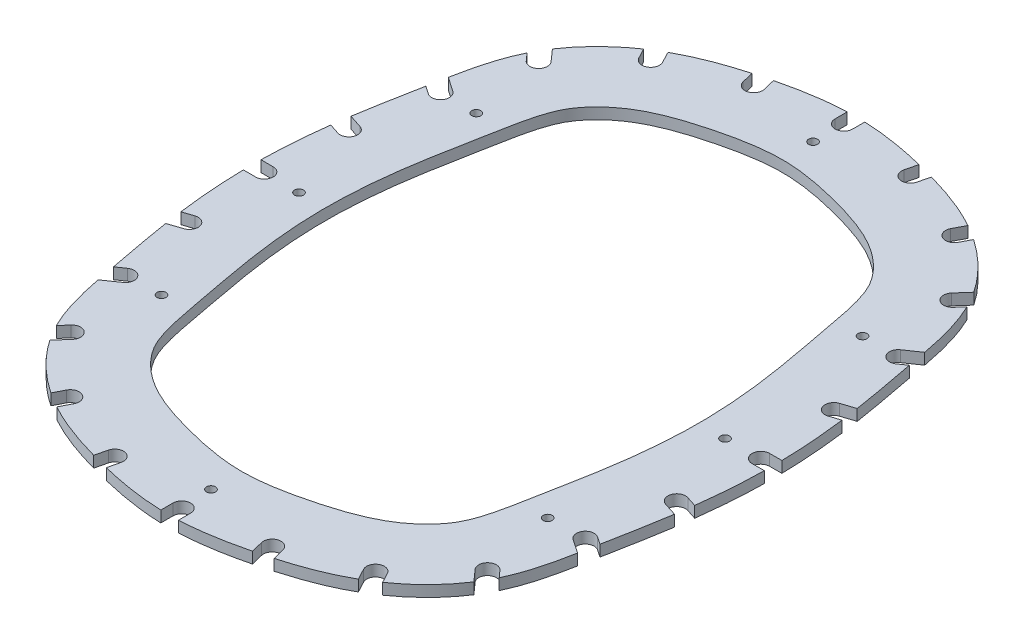
from build123d import *

# Parameters (mm, degrees)
MAINBODY_DEPTH         = 6.35
EXTRUDE2LIP_DEPTH      = 6.35
SLOTS_REACH            = 247.285
OUTERRIDGE_DEPTH       = 246.211628025
F_10_CLEARANCE_HOLE1_D = 5.1054


with BuildPart() as part:
    # Sketch3 → MainBody (new body)
    with BuildSketch(Plane(origin=(0, 0, 0), x_dir=(1, 0, 0), z_dir=(0, 1, 0))):
        with BuildLine():
            add(Edge.make_bspline(
                [(0, 188.5), (-14.941162527, 188.5), (-44.823487582, 182.843892452), (-87.706049673, 168.159111938), (-121.852313727, 134.636427653), (-129.884695419, 89.134437602), (-138.621843095, 45.225812557), (-142.191717787, 0), (-138.621843095, -45.225812557), (-129.884695419, -89.134437602), (-121.852313727, -134.636427653), (-87.706049673, -168.159111938), (-44.823487582, -182.843892452), (0, -191.328053774), (44.823487582, -182.843892452), (87.706049673, -168.159111938), (121.852313727, -134.636427653), (129.884695419, -89.134437602), (138.621843095, -45.225812557), (142.191717787, 0), (138.621843095, 45.225812557), (129.884695419, 89.134437602), (121.852313727, 134.636427653), (87.706049673, 168.159111938), (44.823487582, 182.843892452), (14.941162527, 188.5), (0, 188.5)],
                knots=[0, 0, 0, 0, 0.041635793, 0.083271585, 0.124907378, 0.16654317, 0.208178963, 0.25, 0.291821037, 0.33345683, 0.375092622, 0.416728415, 0.458364207, 0.5, 0.541635793, 0.583271585, 0.624907378, 0.66654317, 0.708178963, 0.75, 0.791821037, 0.83345683, 0.875092622, 0.916728415, 0.958364207, 1, 1, 1, 1], degree=3))
        make_face()
    extrude(amount=MAINBODY_DEPTH)

    # Sketch13 → Extrude2Lip (add)
    with BuildSketch(Plane(origin=(0, 6.35, 0), x_dir=(1, 0, 0), z_dir=(0, 1, 0))):
        with BuildLine():
            add(Edge.make_bspline(
                [(0, -195.5), (5.906115375, -195.5), (11.739195872, -195.084984565), (23.298077894, -193.645348644), (29.023728053, -192.619868034), (37.555871291, -190.761544581), (40.39049511, -190.088552644), (46.044676215, -188.656954276), (48.864921579, -187.902257804), (53.082890192, -186.699754208), (54.486714442, -186.286615582), (57.289305258, -185.431598406), (58.688243661, -184.989623348), (62.860379765, -183.619676082), (65.613822792, -182.646192636), (73.77141149, -179.504754903), (79.072754195, -177.115678614), (86.746243908, -172.932977756), (89.257491392, -171.438548603), (92.946316747, -169.029033652), (94.165319291, -168.196511607), (96.557546407, -166.488918083), (97.732563489, -165.612814334), (101.194392523, -162.917653202), (103.418219259, -161.031996528), (107.69233996, -157.077193142), (109.742668291, -155.00808277), (112.677958925, -151.756170601), (113.632956768, -150.647422967), (115.028372949, -148.945093257), (115.487326488, -148.371109928), (116.392474829, -147.20965244), (116.839338405, -146.621257934), (119.030573362, -143.658210244), (120.64656578, -141.220867563), (123.591597471, -136.206042865), (124.915266819, -133.625938338), (127.292327657, -128.33373366), (128.348545396, -125.623013765), (129.772332418, -121.478531188), (130.220196568, -120.083982119), (131.069128633, -117.272030098), (131.469388991, -115.857107224), (132.604182694, -111.609548526), (133.275494683, -108.765553515), (134.514450297, -103.062613421), (135.081938087, -100.203645864), (136.177461847, -94.480021381), (136.706994613, -91.615580309), (138.3251321, -83.026516956), (139.421519585, -77.303017032), (141.529256477, -65.843753794), (142.540336408, -60.10795162), (143.90345449, -51.482111775), (144.332272137, -48.60314652), (145.124685679, -42.835810343), (145.488497948, -39.947470625), (147.136247264, -25.481067032), (147.910082799, -13.829441133), (148.003006893, -0.609217968), (148.0023736, 0.862331764), (147.979203162, 3.801894823), (147.956752685, 5.27006874), (147.857814722, 9.669916978), (147.749754953, 12.596919894), (147.306795971, 21.360354119), (146.853296686, 27.179237475), (145.66507575, 38.7753948), (144.928391479, 44.552378381), (143.212586909, 56.070474943), (142.23886945, 61.812387324), (140.177500227, 73.279354476), (139.090111019, 79.004448095), (137.464486442, 87.592896267), (136.926184428, 90.456240959), (135.853126125, 96.183454965), (135.312193466, 99.046410429), (133.578587399, 107.618881764), (132.277900519, 113.312416067), (130.135273916, 120.352873454), (129.682357657, 121.751377667), (128.723343105, 124.518671013), (128.21689863, 125.888607747), (126.60731386, 129.952483687), (125.413822323, 132.600437786), (122.738479294, 137.749582497), (121.254404044, 140.249641308), (118.821507232, 143.894484911), (117.976071295, 145.091888782), (116.217688583, 147.452336253), (115.303326613, 148.616751432), (112.494248952, 152.019914378), (110.524173049, 154.182685716), (106.407673375, 158.316218743), (104.261183057, 160.286907974), (99.801271424, 164.046529989), (97.487838734, 165.835450387), (93.893881499, 168.384027148), (92.672428471, 169.212783092), (90.202682616, 170.815071843), (88.955394486, 171.587904561), (82.659783468, 175.317135892), (77.434836444, 177.870760382), (66.703482616, 182.336167776), (61.196906491, 184.247564558), (54.197768861, 186.372472039), (52.7909995, 186.784579313), (49.973582507, 187.584202272), (48.563427693, 187.971611211), (44.329352787, 189.102877354), (41.502078374, 189.8179704), (33.003161014, 191.816663072), (27.314350217, 192.953043965), (15.870842915, 194.660818892), (10.116213474, 195.23278801), (1.418194954, 195.524137097), (-1.492514209, 195.52375573), (-7.337173544, 195.323695383), (-10.270807364, 195.126729205), (-14.686612566, 194.699611386), (-16.160898761, 194.535232112), (-19.094296849, 194.167885124), (-20.556040537, 193.964686132), (-24.927681058, 193.301538591), (-27.824004999, 192.788109027), (-36.468107076, 191.071020911), (-42.17153696, 189.692617767), (-53.502576857, 186.637059847), (-59.126183681, 184.944131381), (-66.062440425, 182.460532517), (-67.445015269, 181.945386002), (-70.199719123, 180.87393344), (-71.573716066, 180.316823815), (-75.663913573, 178.58323116), (-78.343211305, 177.346845481), (-83.593471613, 174.690118255), (-86.164439878, 173.26978637), (-91.185757227, 170.224308146), (-93.635715508, 168.598498213), (-97.216876261, 166.000548133), (-98.394954126, 165.108003602), (-100.718882108, 163.268190998), (-101.865533518, 162.320007853), (-105.223402308, 159.418577369), (-107.363729115, 157.40037992), (-111.441834365, 153.191002694), (-113.37964364, 150.999849249), (-117.037838488, 146.431856051), (-118.758320666, 144.055098803), (-121.156847892, 140.33436209), (-121.925899347, 139.068104806), (-123.030384879, 137.12679315), (-123.389793208, 136.473601532), (-124.087032538, 135.161787057), (-124.425457864, 134.502197826), (-126.069185967, 131.186771085), (-127.229427255, 128.478540244), (-130.340842927, 120.220460927), (-131.92233491, 114.537090503), (-134.590856441, 102.991759635), (-135.664344943, 97.192136998), (-137.835547346, 85.598679936), (-138.947717024, 79.804324746), (-141.102949482, 68.209441102), (-142.14514109, 62.408834827), (-143.561835264, 53.694830359), (-144.009674048, 50.787983231), (-144.84185299, 44.968616694), (-145.225531441, 42.056038176), (-146.969951254, 27.477604764), (-147.81497066, 15.765680845), (-148.05214775, -1.894245549), (-147.953847743, -7.79673102), (-147.422537103, -19.631601392), (-146.990917008, -25.563862077), (-146.11429037, -34.482727043), (-145.783752506, -37.459181062), (-145.052722161, -43.394087641), (-144.65146401, -46.355639149), (-143.351636068, -55.224433593), (-142.359953908, -61.116302074), (-140.253044804, -72.879639666), (-139.138099116, -78.751155218), (-137.470827885, -87.559278454), (-136.918863825, -90.495966622), (-135.818089008, -96.369779148), (-135.262680803, -99.305273048), (-133.479399827, -108.07882648), (-132.135206603, -113.88416476), (-129.48930931, -122.415061922), (-128.50239561, -125.229172176), (-126.811717352, -129.391177437), (-126.213066806, -130.768641296), (-125.255339139, -132.818028732), (-124.92625704, -133.497986535), (-124.251641166, -134.84302841), (-123.905599809, -135.509198789), (-122.13060998, -138.807486431), (-120.568758369, -141.342962393), (-117.192510934, -146.230275301), (-115.377996564, -148.582026046), (-111.51485991, -153.115294585), (-109.464652362, -155.298278425), (-105.144856894, -159.494038584), (-102.903607584, -161.479745044), (-95.95434675, -167.12591042), (-91.021134394, -170.475845637), (-84.496742878, -174.169798449), (-83.171637731, -174.885618839), (-80.502800709, -176.26321899), (-79.159431703, -176.92498945), (-75.104662865, -178.835824554), (-72.368619207, -180.010467263), (-64.078607471, -183.287123531), (-58.442856204, -185.142159887), (-49.888781887, -187.621373091), (-47.021062012, -188.398366556), (-41.260502164, -189.876493257), (-38.366430247, -190.573906142), (-32.542929173, -191.86195652), (-29.609900622, -192.453109041), (-23.734953504, -193.497503723), (-20.790109937, -193.951534575), (-14.883056044, -194.698968084), (-11.920847988, -194.992391742), (-7.462425561, -195.292769035), (-5.973764921, -195.369588436), (-3.736717617, -195.447299706), (-2.617179714, -195.476774359), (-1.309214561, -195.494165182), (-0.654764607, -195.498537732), (-0.374185041, -195.499477379), (-0.187109452, -195.499895297), (-0.092283053, -195.5), (0, -195.5)],
                knots=[0, 0, 0, 0, 0.015625, 0.015625, 0.03125, 0.03125, 0.0390625, 0.0390625, 0.046875, 0.046875, 0.05078125, 0.05078125, 0.0546875, 0.0546875, 0.0625, 0.0625, 0.078125, 0.078125, 0.0859375, 0.0859375, 0.08984375, 0.08984375, 0.09375, 0.09375, 0.1015625, 0.1015625, 0.109375, 0.109375, 0.11328125, 0.11328125, 0.115234375, 0.115234375, 0.1171875, 0.1171875, 0.125, 0.125, 0.1328125, 0.1328125, 0.140625, 0.140625, 0.14453125, 0.14453125, 0.1484375, 0.1484375, 0.15625, 0.15625, 0.1640625, 0.1640625, 0.171875, 0.171875, 0.1875, 0.1875, 0.203125, 0.203125, 0.2109375, 0.2109375, 0.21875, 0.21875, 0.25, 0.25, 0.25390625, 0.25390625, 0.2578125, 0.2578125, 0.265625, 0.265625, 0.28125, 0.28125, 0.296875, 0.296875, 0.3125, 0.3125, 0.328125, 0.328125, 0.3359375, 0.3359375, 0.34375, 0.34375, 0.359375, 0.359375, 0.36328125, 0.36328125, 0.3671875, 0.3671875, 0.375, 0.375, 0.3828125, 0.3828125, 0.38671875, 0.38671875, 0.390625, 0.390625, 0.3984375, 0.3984375, 0.40625, 0.40625, 0.4140625, 0.4140625, 0.41796875, 0.41796875, 0.421875, 0.421875, 0.4375, 0.4375, 0.453125, 0.453125, 0.45703125, 0.45703125, 0.4609375, 0.4609375, 0.46875, 0.46875, 0.484375, 0.484375, 0.5, 0.5, 0.5078125, 0.5078125, 0.515625, 0.515625, 0.51953125, 0.51953125, 0.5234375, 0.5234375, 0.53125, 0.53125, 0.546875, 0.546875, 0.5625, 0.5625, 0.56640625, 0.56640625, 0.5703125, 0.5703125, 0.578125, 0.578125, 0.5859375, 0.5859375, 0.59375, 0.59375, 0.59765625, 0.59765625, 0.6015625, 0.6015625, 0.609375, 0.609375, 0.6171875, 0.6171875, 0.625, 0.625, 0.62890625, 0.62890625, 0.630859375, 0.630859375, 0.6328125, 0.6328125, 0.640625, 0.640625, 0.65625, 0.65625, 0.671875, 0.671875, 0.6875, 0.6875, 0.703125, 0.703125, 0.7109375, 0.7109375, 0.71875, 0.71875, 0.75, 0.75, 0.765625, 0.765625, 0.78125, 0.78125, 0.7890625, 0.7890625, 0.796875, 0.796875, 0.8125, 0.8125, 0.828125, 0.828125, 0.8359375, 0.8359375, 0.84375, 0.84375, 0.859375, 0.859375, 0.8671875, 0.8671875, 0.87109375, 0.87109375, 0.873046875, 0.873046875, 0.875, 0.875, 0.8828125, 0.8828125, 0.890625, 0.890625, 0.8984375, 0.8984375, 0.90625, 0.90625, 0.921875, 0.921875, 0.92578125, 0.92578125, 0.9296875, 0.9296875, 0.9375, 0.9375, 0.953125, 0.953125, 0.9609375, 0.9609375, 0.96875, 0.96875, 0.9765625, 0.9765625, 0.984375, 0.984375, 0.9921875, 0.9921875, 0.99609375, 0.99609375, 0.998046875, 0.999023438, 0.999511719, 0.999755859, 0.999755859, 1, 1, 1, 1], degree=3))
        make_face()
    extrude(amount=-EXTRUDE2LIP_DEPTH)

    # Sketch14 → Slots (cut, up to next)
    with BuildSketch(Plane(origin=(0, 6.35, 0), x_dir=(1, 0, 0), z_dir=(0, 1, 0)), mode=Mode.PRIVATE) as slots_sk1:
        with BuildLine():
            Line((-5, 188.5), (-5, 199.179815437))
            Line((-5, 199.179815437), (5, 199.179815437))
            Line((5, 199.179815437), (5, 188.5))
            ThreePointArc((5, 188.5), (0, 183.5), (-5, 188.5))
        make_face()
    slots_tool1 = extrude(slots_sk1.sketch, amount=-SLOTS_REACH, mode=Mode.PRIVATE) & part.part
    # Sketch14 → Slots (cut, up to next)
    with BuildSketch(Plane(origin=(0, 6.35, 0), x_dir=(1, 0, 0), z_dir=(0, 1, 0)), mode=Mode.PRIVATE) as slots_sk2:
        with BuildLine():
            Line((39.64335913, 182.999169284), (42.182406998, 193.372774911))
            Line((42.182406998, 193.372774911), (51.895688737, 190.995348183))
            Line((51.895688737, 190.995348183), (49.35664087, 180.621742556))
            ThreePointArc((49.35664087, 180.621742556), (43.311286636, 176.95381505), (39.64335913, 182.999169284))
        make_face()
    slots_tool2 = extrude(slots_sk2.sketch, amount=-SLOTS_REACH, mode=Mode.PRIVATE) & part.part
    # Sketch14 → Slots (cut, up to next)
    with BuildSketch(Plane(origin=(0, 6.35, 0), x_dir=(1, 0, 0), z_dir=(0, 1, 0)), mode=Mode.PRIVATE) as slots_sk3:
        with BuildLine():
            Line((81.818760635, 167.335517805), (86.765771818, 176.800481521))
            Line((86.765771818, 176.800481521), (95.628250548, 172.16836853))
            Line((95.628250548, 172.16836853), (90.681239365, 162.703404814))
            ThreePointArc((90.681239365, 162.703404814), (83.933943505, 160.588221945), (81.818760635, 167.335517805))
        make_face()
    slots_tool3 = extrude(slots_sk3.sketch, amount=-SLOTS_REACH, mode=Mode.PRIVATE) & part.part
    # Sketch14 → Slots (cut, up to next)
    with BuildSketch(Plane(origin=(0, 6.35, 0), x_dir=(1, 0, 0), z_dir=(0, 1, 0)), mode=Mode.PRIVATE) as slots_sk4:
        with BuildLine():
            Line((113.757324738, 135.955352809), (125.889061564, 149.6502641))
            Line((125.889061564, 149.6502641), (133.374412089, 143.019311866))
            Line((133.374412089, 143.019311866), (121.242675262, 129.324400575))
            ThreePointArc((121.242675262, 129.324400575), (114.184523883, 128.89720143), (113.757324738, 135.955352809))
        make_face()
    slots_tool4 = extrude(slots_sk4.sketch, amount=-SLOTS_REACH, mode=Mode.PRIVATE) & part.part
    # Sketch14 → Slots (cut, up to next)
    with BuildSketch(Plane(origin=(0, 6.35, 0), x_dir=(1, 0, 0), z_dir=(0, 1, 0)), mode=Mode.PRIVATE) as slots_sk5:
        with BuildLine():
            Line((127.166584796, 93.530514919), (142.252668174, 103.906355838))
            Line((142.252668174, 103.906355838), (147.91949858, 95.666997057))
            Line((147.91949858, 95.666997057), (132.833415203, 85.291156137))
            ThreePointArc((132.833415203, 85.291156137), (125.880320609, 86.577420324), (127.166584796, 93.530514919))
        make_face()
    slots_tool5 = extrude(slots_sk5.sketch, amount=-SLOTS_REACH, mode=Mode.PRIVATE) & part.part
    # Sketch14 → Slots (cut, up to next)
    with BuildSketch(Plane(origin=(0, 6.35, 0), x_dir=(1, 0, 0), z_dir=(0, 1, 0)), mode=Mode.PRIVATE) as slots_sk6:
        with BuildLine():
            Line((136.194761018, 49.835191332), (153.596269533, 55.530407567))
            Line((153.596269533, 55.530407567), (156.706747497, 46.026464867))
            Line((156.706747497, 46.026464867), (139.305238982, 40.331248632))
            ThreePointArc((139.305238982, 40.331248632), (132.99802865, 43.527981), (136.194761018, 49.835191332))
        make_face()
    slots_tool6 = extrude(slots_sk6.sketch, amount=-SLOTS_REACH, mode=Mode.PRIVATE) & part.part
    # Sketch14 → Slots (cut, up to next)
    with BuildSketch(Plane(origin=(0, 6.35, 0), x_dir=(1, 0, 0), z_dir=(0, 1, 0)), mode=Mode.PRIVATE) as slots_sk7:
        with BuildLine():
            Line((140.987818654, 5.34350015), (159.297542756, 5.388107701))
            Line((159.297542756, 5.388107701), (159.321905449, -4.611862622))
            Line((159.321905449, -4.611862622), (141.012181346, -4.656470173))
            ThreePointArc((141.012181346, -4.656470173), (136.000014839, 0.331333642), (140.987818654, 5.34350015))
        make_face()
    slots_tool7 = extrude(slots_sk7.sketch, amount=-SLOTS_REACH, mode=Mode.PRIVATE) & part.part
    # Sketch14 → Slots (cut, up to next)
    with BuildSketch(Plane(origin=(0, 6.35, 0), x_dir=(1, 0, 0), z_dir=(0, 1, 0)), mode=Mode.PRIVATE) as slots_sk8:
        with BuildLine():
            Line((-159.321905449, -4.611862622), (-141.012181346, -4.656470173))
            ThreePointArc((-141.012181346, -4.656470173), (-136.000014839, 0.331333642), (-140.987818654, 5.34350015))
            Line((-140.987818654, 5.34350015), (-159.297542756, 5.388107701))
            Line((-159.297542756, 5.388107701), (-159.321905449, -4.611862622))
        make_face()
    slots_tool8 = extrude(slots_sk8.sketch, amount=-SLOTS_REACH, mode=Mode.PRIVATE) & part.part
    # Sketch14 → Slots (cut, up to next)
    with BuildSketch(Plane(origin=(0, 6.35, 0), x_dir=(1, 0, 0), z_dir=(0, 1, 0)), mode=Mode.PRIVATE) as slots_sk9:
        with BuildLine():
            Line((-156.706747497, 46.026464867), (-139.305238982, 40.331248632))
            ThreePointArc((-139.305238982, 40.331248632), (-132.99802865, 43.527981), (-136.194761018, 49.835191332))
            Line((-136.194761018, 49.835191332), (-153.596269533, 55.530407567))
            Line((-153.596269533, 55.530407567), (-156.706747497, 46.026464867))
        make_face()
    slots_tool9 = extrude(slots_sk9.sketch, amount=-SLOTS_REACH, mode=Mode.PRIVATE) & part.part
    # Sketch14 → Slots (cut, up to next)
    with BuildSketch(Plane(origin=(0, 6.35, 0), x_dir=(1, 0, 0), z_dir=(0, 1, 0)), mode=Mode.PRIVATE) as slots_sk10:
        with BuildLine():
            Line((-147.91949858, 95.666997057), (-132.833415203, 85.291156137))
            ThreePointArc((-132.833415203, 85.291156137), (-125.880320609, 86.577420324), (-127.166584796, 93.530514919))
            Line((-127.166584796, 93.530514919), (-142.252668174, 103.906355838))
            Line((-142.252668174, 103.906355838), (-147.91949858, 95.666997057))
        make_face()
    slots_tool10 = extrude(slots_sk10.sketch, amount=-SLOTS_REACH, mode=Mode.PRIVATE) & part.part
    # Sketch14 → Slots (cut, up to next)
    with BuildSketch(Plane(origin=(0, 6.35, 0), x_dir=(1, 0, 0), z_dir=(0, 1, 0)), mode=Mode.PRIVATE) as slots_sk11:
        with BuildLine():
            Line((-133.374412089, 143.019311866), (-121.242675262, 129.324400575))
            ThreePointArc((-121.242675262, 129.324400575), (-114.184523883, 128.89720143), (-113.757324738, 135.955352809))
            Line((-113.757324738, 135.955352809), (-125.889061564, 149.6502641))
            Line((-125.889061564, 149.6502641), (-133.374412089, 143.019311866))
        make_face()
    slots_tool11 = extrude(slots_sk11.sketch, amount=-SLOTS_REACH, mode=Mode.PRIVATE) & part.part
    # Sketch14 → Slots (cut, up to next)
    with BuildSketch(Plane(origin=(0, 6.35, 0), x_dir=(1, 0, 0), z_dir=(0, 1, 0)), mode=Mode.PRIVATE) as slots_sk12:
        with BuildLine():
            Line((-95.628250548, 172.16836853), (-90.681239365, 162.703404814))
            ThreePointArc((-90.681239365, 162.703404814), (-83.933943505, 160.588221945), (-81.818760635, 167.335517805))
            Line((-81.818760635, 167.335517805), (-86.765771818, 176.800481521))
            Line((-86.765771818, 176.800481521), (-95.628250548, 172.16836853))
        make_face()
    slots_tool12 = extrude(slots_sk12.sketch, amount=-SLOTS_REACH, mode=Mode.PRIVATE) & part.part
    # Sketch14 → Slots (cut, up to next)
    with BuildSketch(Plane(origin=(0, 6.35, 0), x_dir=(1, 0, 0), z_dir=(0, 1, 0)), mode=Mode.PRIVATE) as slots_sk13:
        with BuildLine():
            Line((-51.895688737, 190.995348183), (-49.35664087, 180.621742556))
            ThreePointArc((-49.35664087, 180.621742556), (-43.311286636, 176.95381505), (-39.64335913, 182.999169284))
            Line((-39.64335913, 182.999169284), (-42.182406998, 193.372774911))
            Line((-42.182406998, 193.372774911), (-51.895688737, 190.995348183))
        make_face()
    slots_tool13 = extrude(slots_sk13.sketch, amount=-SLOTS_REACH, mode=Mode.PRIVATE) & part.part
    # Sketch14 → Slots (cut, up to next)
    with BuildSketch(Plane(origin=(0, 6.35, 0), x_dir=(1, 0, 0), z_dir=(0, 1, 0)), mode=Mode.PRIVATE) as slots_sk14:
        with BuildLine():
            Line((-38.751220666, -183.190160158), (-41.23969275, -193.576014214))
            Line((-41.23969275, -193.576014214), (-50.964443254, -191.245943907))
            Line((-50.964443254, -191.245943907), (-48.47597117, -180.860089851))
            ThreePointArc((-48.47597117, -180.860089851), (-42.448560765, -177.162749752), (-38.751220666, -183.190160158))
        make_face()
    slots_tool14 = extrude(slots_sk14.sketch, amount=-SLOTS_REACH, mode=Mode.PRIVATE) & part.part
    # Sketch14 → Slots (cut, up to next)
    with BuildSketch(Plane(origin=(0, 6.35, 0), x_dir=(1, 0, 0), z_dir=(0, 1, 0)), mode=Mode.PRIVATE) as slots_sk15:
        with BuildLine():
            Line((-81.002443034, -167.73219528), (-85.903277228, -177.22115107))
            Line((-85.903277228, -177.22115107), (-94.788220835, -172.632275707))
            Line((-94.788220835, -172.632275707), (-89.887386642, -163.143319917))
            ThreePointArc((-89.887386642, -163.143319917), (-83.150477157, -160.995285795), (-81.002443034, -167.73219528))
        make_face()
    slots_tool15 = extrude(slots_sk15.sketch, amount=-SLOTS_REACH, mode=Mode.PRIVATE) & part.part
    # Sketch14 → Slots (cut, up to next)
    with BuildSketch(Plane(origin=(0, 6.35, 0), x_dir=(1, 0, 0), z_dir=(0, 1, 0)), mode=Mode.PRIVATE) as slots_sk16:
        with BuildLine():
            Line((-113.093528611, -136.508024216), (-125.158392638, -150.261885117))
            Line((-125.158392638, -150.261885117), (-132.67596378, -143.667484149))
            Line((-132.67596378, -143.667484149), (-120.611099753, -129.913623248))
            ThreePointArc((-120.611099753, -129.913623248), (-113.555113698, -129.452038161), (-113.093528611, -136.508024216))
        make_face()
    slots_tool16 = extrude(slots_sk16.sketch, amount=-SLOTS_REACH, mode=Mode.PRIVATE) & part.part
    # Sketch14 → Slots (cut, up to next)
    with BuildSketch(Plane(origin=(0, 6.35, 0), x_dir=(1, 0, 0), z_dir=(0, 1, 0)), mode=Mode.PRIVATE) as slots_sk17:
        with BuildLine():
            Line((-126.709345536, -94.149026886), (-141.744693295, -104.59825194))
            Line((-141.744693295, -104.59825194), (-147.451602905, -96.386602736))
            Line((-147.451602905, -96.386602736), (-132.416255148, -85.93737768))
            ThreePointArc((-132.416255148, -85.93737768), (-125.456975739, -87.189747477), (-126.709345536, -94.149026886))
        make_face()
    slots_tool17 = extrude(slots_sk17.sketch, amount=-SLOTS_REACH, mode=Mode.PRIVATE) & part.part
    # Sketch14 → Slots (cut, up to next)
    with BuildSketch(Plane(origin=(0, 6.35, 0), x_dir=(1, 0, 0), z_dir=(0, 1, 0)), mode=Mode.PRIVATE) as slots_sk18:
        with BuildLine():
            Line((-135.950321104, -50.498212004), (-153.32387297, -56.278149902))
            Line((-153.32387297, -56.278149902), (-156.4806222, -46.789475901))
            Line((-156.4806222, -46.789475901), (-139.107070333, -41.009538003))
            ThreePointArc((-139.107070333, -41.009538003), (-132.784358718, -44.175500389), (-135.950321104, -50.498212004))
        make_face()
    slots_tool18 = extrude(slots_sk18.sketch, amount=-SLOTS_REACH, mode=Mode.PRIVATE) & part.part
    # Sketch14 → Slots (cut, up to next)
    with BuildSketch(Plane(origin=(0, 6.35, 0), x_dir=(1, 0, 0), z_dir=(0, 1, 0)), mode=Mode.PRIVATE) as slots_sk19:
        with BuildLine():
            Line((156.929152319, -45.262361089), (139.500100296, -39.652001731))
            ThreePointArc((139.500100296, -39.652001731), (133.208540992, -42.879428186), (136.435967447, -49.17098749))
            Line((136.435967447, -49.17098749), (153.86501947, -54.781346849))
            Line((153.86501947, -54.781346849), (156.929152319, -45.262361089))
        make_face()
    slots_tool19 = extrude(slots_sk19.sketch, amount=-SLOTS_REACH, mode=Mode.PRIVATE) & part.part
    # Sketch14 → Slots (cut, up to next)
    with BuildSketch(Plane(origin=(0, 6.35, 0), x_dir=(1, 0, 0), z_dir=(0, 1, 0)), mode=Mode.PRIVATE) as slots_sk20:
        with BuildLine():
            Line((148.383882405, -94.945120089), (133.247421577, -84.642909643))
            ThreePointArc((133.247421577, -84.642909643), (126.300676875, -85.963037682), (127.620804915, -92.909782384))
            Line((127.620804915, -92.909782384), (142.757265743, -103.211992829))
            Line((142.757265743, -103.211992829), (148.383882405, -94.945120089))
        make_face()
    slots_tool20 = extrude(slots_sk20.sketch, amount=-SLOTS_REACH, mode=Mode.PRIVATE) & part.part
    # Sketch14 → Slots (cut, up to next)
    with BuildSketch(Plane(origin=(0, 6.35, 0), x_dir=(1, 0, 0), z_dir=(0, 1, 0)), mode=Mode.PRIVATE) as slots_sk21:
        with BuildLine():
            Line((134.069693871, -142.367744072), (121.871372273, -128.732107531))
            ThreePointArc((121.871372273, -128.732107531), (114.811223142, -128.339304469), (114.41842008, -135.3994536))
            Line((114.41842008, -135.3994536), (126.616741678, -149.035090141))
            Line((126.616741678, -149.035090141), (134.069693871, -142.367744072))
        make_face()
    slots_tool21 = extrude(slots_sk21.sketch, amount=-SLOTS_REACH, mode=Mode.PRIVATE) & part.part
    # Sketch14 → Slots (cut, up to next)
    with BuildSketch(Plane(origin=(0, 6.35, 0), x_dir=(1, 0, 0), z_dir=(0, 1, 0)), mode=Mode.PRIVATE) as slots_sk22:
        with BuildLine():
            Line((96.466009889, -171.700373794), (91.472939168, -162.259626867))
            ThreePointArc((91.472939168, -162.259626867), (84.715417124, -160.177345468), (82.633135725, -166.934867512))
            Line((82.633135725, -166.934867512), (87.626206446, -176.375614439))
            Line((87.626206446, -176.375614439), (96.466009889, -171.700373794))
        make_face()
    slots_tool22 = extrude(slots_sk22.sketch, amount=-SLOTS_REACH, mode=Mode.PRIVATE) & part.part
    # Sketch14 → Slots (cut, up to next)
    with BuildSketch(Plane(origin=(0, 6.35, 0), x_dir=(1, 0, 0), z_dir=(0, 1, 0)), mode=Mode.PRIVATE) as slots_sk23:
        with BuildLine():
            Line((52.825702132, -190.740217917), (50.236138762, -180.379107005))
            ThreePointArc((50.236138762, -180.379107005), (44.172984226, -176.740679175), (40.534556396, -182.803833711))
            Line((40.534556396, -182.803833711), (43.124119767, -193.164944623))
            Line((43.124119767, -193.164944623), (52.825702132, -190.740217917))
        make_face()
    slots_tool23 = extrude(slots_sk23.sketch, amount=-SLOTS_REACH, mode=Mode.PRIVATE) & part.part
    # Sketch14 → Slots (cut, up to next)
    with BuildSketch(Plane(origin=(0, 6.35, 0), x_dir=(1, 0, 0), z_dir=(0, 1, 0)), mode=Mode.PRIVATE) as slots_sk24:
        with BuildLine():
            Line((5.970449099, -199.15308839), (5.918411441, -188.473399731))
            ThreePointArc((5.918411441, -188.473399731), (0.894108175, -183.497821705), (-4.081469851, -188.522124972))
            Line((-4.081469851, -188.522124972), (-4.029432193, -199.201813631))
            Line((-4.029432193, -199.201813631), (5.970449099, -199.15308839))
        make_face()
    slots_tool24 = extrude(slots_sk24.sketch, amount=-SLOTS_REACH, mode=Mode.PRIVATE) & part.part
    add(slots_tool1.solids().sort_by_distance((0, 6.35, -191.833781))[0], mode=Mode.SUBTRACT)
    add(slots_tool2.solids().sort_by_distance((45.292582, 6.35, -185.048651))[0], mode=Mode.SUBTRACT)
    add(slots_tool3.solids().sort_by_distance((87.794245, 6.35, -167.974018))[0], mode=Mode.SUBTRACT)
    add(slots_tool4.solids().sort_by_distance((122.245303, 6.35, -137.996612))[0], mode=Mode.SUBTRACT)
    add(slots_tool5.solids().sort_by_distance((135.902174, 6.35, -93.470207))[0], mode=Mode.SUBTRACT)
    add(slots_tool6.solids().sort_by_distance((144.558045, 6.35, -47.311377))[0], mode=Mode.SUBTRACT)
    add(slots_tool7.solids().sort_by_distance((148.163369, 6.35, -0.360967))[0], mode=Mode.SUBTRACT)
    add(slots_tool8.solids().sort_by_distance((-148.163369, 6.35, -0.360967))[0], mode=Mode.SUBTRACT)
    add(slots_tool9.solids().sort_by_distance((-144.558045, 6.35, -47.311377))[0], mode=Mode.SUBTRACT)
    add(slots_tool10.solids().sort_by_distance((-135.902174, 6.35, -93.470207))[0], mode=Mode.SUBTRACT)
    add(slots_tool11.solids().sort_by_distance((-122.245303, 6.35, -137.996612))[0], mode=Mode.SUBTRACT)
    add(slots_tool12.solids().sort_by_distance((-87.794245, 6.35, -167.974018))[0], mode=Mode.SUBTRACT)
    add(slots_tool13.solids().sort_by_distance((-45.292582, 6.35, -185.048651))[0], mode=Mode.SUBTRACT)
    add(slots_tool14.solids().sort_by_distance((-44.39039, 6.35, 185.267144))[0], mode=Mode.SUBTRACT)
    add(slots_tool15.solids().sort_by_distance((-86.974745, 6.35, 168.399803))[0], mode=Mode.SUBTRACT)
    add(slots_tool16.solids().sort_by_distance((-121.57146, 6.35, 138.590617))[0], mode=Mode.SUBTRACT)
    add(slots_tool17.solids().sort_by_distance((-135.445125, 6.35, 94.131284))[0], mode=Mode.SUBTRACT)
    add(slots_tool18.solids().sort_by_distance((-144.325803, 6.35, 48.015178))[0], mode=Mode.SUBTRACT)
    add(slots_tool19.solids().sort_by_distance((144.786855, 6.35, 46.606453))[0], mode=Mode.SUBTRACT)
    add(slots_tool20.solids().sort_by_distance((136.355997, 6.35, 92.806911))[0], mode=Mode.SUBTRACT)
    add(slots_tool21.solids().sort_by_distance((122.916244, 6.35, 137.399331))[0], mode=Mode.SUBTRACT)
    add(slots_tool22.solids().sort_by_distance((88.61166, 6.35, 167.544244))[0], mode=Mode.SUBTRACT)
    add(slots_tool23.solids().sort_by_distance((46.193698, 6.35, 184.825766))[0], mode=Mode.SUBTRACT)
    add(slots_tool24.solids().sort_by_distance((0.934715, 6.35, 191.831504))[0], mode=Mode.SUBTRACT)

    # Sketch16 → OuterRidge (cut, through all)
    with BuildSketch(Plane(origin=(0, 6.35, 0), x_dir=(1, 0, 0), z_dir=(0, 1, 0))):
        with BuildLine():
            add(Edge.make_bspline(
                [(0, -153.5), (2.306090439, -153.5), (4.59507442, -153.404848109), (9.146060709, -153.064463163), (11.408041585, -152.819110892), (18.161739054, -151.903695631), (22.62155258, -151.056177022), (29.27107079, -149.561281577), (31.480774191, -149.025144359), (35.889627975, -147.894170472), (38.089287532, -147.302166006), (42.476128436, -146.048749058), (44.666066498, -145.385268741), (49.004421554, -143.965382583), (51.154281243, -143.208721482), (55.402550827, -141.570973739), (57.50099176, -140.68996216), (61.63062524, -138.765306338), (63.663817442, -137.720562629), (67.635100714, -135.425539255), (69.547611927, -134.186593176), (73.221026681, -131.519147136), (74.983197428, -130.092231553), (77.504202283, -127.799008383), (78.324029539, -127.008960049), (79.520148257, -125.781850018), (79.913238045, -125.365791136), (80.68752287, -124.518801459), (81.068921769, -124.087566523), (82.929570636, -121.909372634), (84.283899353, -120.08502306), (86.066242138, -117.196631522), (86.616972964, -116.207390385), (87.62623443, -114.172708367), (88.087848879, -113.129147193), (88.730805993, -111.533654783), (88.937153956, -110.995862945), (89.333169618, -109.917279678), (89.5229688, -109.376260536), (90.071276719, -107.7487648), (90.408834765, -106.657879137), (91.359243694, -103.372118442), (91.910796886, -101.16434332), (92.925140328, -96.730112929), (93.387247745, -94.503513957), (94.270722732, -90.041742318), (94.691821555, -87.806513094), (95.529564853, -83.335117228), (95.948671239, -81.099468695), (97.215893573, -74.394607219), (98.067186426, -69.926062855), (99.724155204, -60.979374051), (100.53014379, -56.499229584), (102.028429107, -47.52403077), (102.718893316, -43.036286592), (103.913187575, -34.060337773), (104.419804063, -29.572140008), (105.641301962, -16.106810621), (106.05871291, -7.128945082), (105.927763856, 10.829168736), (105.391258009, 19.80938777), (104.006765126, 33.281146637), (103.447727184, 37.771973576), (102.15495177, 46.754058472), (101.423623016, 51.248412897), (99.866808233, 60.219975232), (99.041622319, 64.69713606), (97.362479384, 73.646155781), (96.508539316, 78.118017798), (95.248595129, 84.829674419), (94.833205892, 87.067739535), (93.978411433, 91.539444105), (93.539272472, 93.772334394), (92.595235153, 98.220877797), (92.090732529, 100.436682352), (90.956945872, 104.835766416), (90.32878339, 107.019338263), (89.220723238, 110.251474954), (88.823079936, 111.322262144), (87.952609725, 113.441034467), (87.484046157, 114.478513451), (85.948980181, 117.505910563), (84.74182667, 119.40337712), (82.721172669, 122.111591694), (82.012357558, 122.991150603), (80.900845102, 124.278747538), (80.522269603, 124.702641128), (79.74950298, 125.54016398), (79.35495726, 125.954105798), (77.358892032, 127.984304641), (75.677580597, 129.495311961), (72.170260096, 132.323472291), (70.344012679, 133.640305976), (67.500210821, 135.47564856), (66.534483178, 136.063590858), (64.5697079, 137.194835994), (63.568524243, 137.739384657), (60.535927523, 139.303918933), (58.484949397, 140.251103372), (54.338959815, 142.001180965), (52.243909863, 142.803947972), (45.909225181, 145.049930045), (41.620749077, 146.33309851), (35.137576768, 148.092506644), (32.968667036, 148.653245106), (28.6124448, 149.714418628), (26.424860767, 150.213963924), (22.025306474, 151.133144135), (19.813353441, 151.552835504), (15.35839532, 152.290464838), (13.127683812, 152.60615478), (8.675333226, 153.106111842), (6.451330949, 153.290810188), (2.008557791, 153.503048944), (-0.210119814, 153.527787238), (-6.857464143, 153.34098876), (-11.278187806, 152.89083218), (-17.898359668, 151.887737644), (-20.103242399, 151.498060078), (-23.408317019, 150.845966558), (-24.51057501, 150.61710315), (-26.70860069, 150.140388383), (-27.804488649, 149.892538118), (-31.083893267, 149.123897029), (-33.259175942, 148.578092694), (-37.592974546, 147.435549361), (-39.751619314, 146.839201758), (-46.191909954, 144.941879263), (-50.439011006, 143.535962798), (-56.681513638, 141.037792341), (-58.740752431, 140.139465471), (-61.786782799, 138.661871177), (-62.796365517, 138.146809503), (-64.792908263, 137.070095192), (-65.775356572, 136.510919623), (-68.670962967, 134.765320499), (-70.531435132, 133.509578051), (-74.10964229, 130.810293777), (-75.827802634, 129.367311586), (-78.285636517, 127.045734929), (-79.084881298, 126.245518377), (-80.250431851, 125.001358856), (-80.632980162, 124.579679025), (-81.380473665, 123.727582688), (-81.746135906, 123.296412173), (-83.532482316, 121.113970705), (-84.829660265, 119.284446206), (-86.523413443, 116.380483542), (-87.042611344, 115.383739105), (-87.999014177, 113.338299482), (-88.43910807, 112.288338499), (-89.662497882, 109.097905821), (-90.343319626, 106.942032866), (-91.558666075, 102.598896085), (-92.091459558, 100.411260792), (-93.076094986, 96.018620479), (-93.527362226, 93.813492146), (-94.393931392, 89.395518423), (-94.809000162, 87.182623005), (-95.637578824, 82.756497681), (-96.053495567, 80.543784212), (-97.308499745, 73.907200281), (-98.150442121, 69.483942401), (-99.787832233, 60.627450314), (-100.583835111, 56.190567098), (-102.060919654, 47.315660394), (-102.741373691, 42.87803061), (-103.91946223, 34.002215761), (-104.419923764, 29.564039283), (-105.629659096, 16.248624019), (-106.048380246, 7.370502732), (-105.942614914, -10.388604659), (-105.427823014, -19.269561317), (-104.085986385, -32.592726508), (-103.543179149, -37.034071722), (-102.284395254, -45.917288118), (-101.570355868, -50.359304792), (-99.278515049, -63.684895567), (-97.561782762, -72.533462109), (-95.47755192, -83.605655593), (-95.066144799, -85.82110701), (-94.22793506, -90.249143289), (-93.800373516, -92.46236565), (-92.890000369, -96.873883581), (-92.407542151, -99.072074417), (-91.334898012, -103.438560678), (-90.745529988, -105.607083075), (-89.719338785, -108.820421766), (-89.353302184, -109.884881975), (-88.755986622, -111.468179518), (-88.548796444, -111.993701708), (-88.115539598, -113.03950769), (-87.88905691, -113.560623169), (-87.182352781, -115.102116187), (-86.672528126, -116.103037581), (-85.563305774, -118.042969616), (-84.966815996, -118.983990141), (-83.069677097, -121.732633074), (-81.662534776, -123.466649918), (-79.375380822, -125.945723731), (-78.581128135, -126.753261736), (-76.957770816, -128.309162003), (-76.126556634, -129.060034482), (-73.578777889, -131.23761521), (-71.808525475, -132.589908194), (-68.134914635, -135.10999955), (-66.22945724, -136.274888599), (-63.278583005, -137.893749668), (-62.277391402, -138.413511068), (-60.260886355, -139.408347554), (-59.246140824, -139.883330957), (-56.185000857, -141.249876124), (-54.12179237, -142.083341466), (-47.881624445, -144.409101637), (-43.654857427, -145.729299805), (-37.261820003, -147.526860645), (-35.122248942, -148.096475704), (-30.828399863, -149.184889896), (-28.673411864, -149.701235885), (-22.177245318, -151.142461852), (-17.804030276, -151.962349579), (-11.149758014, -152.848517549), (-8.927394313, -153.084431113), (-5.585975511, -153.328712586), (-4.470854005, -153.391832737), (-2.795984237, -153.456064742), (-2.237329486, -153.472397312), (-1.398770948, -153.48887301), (-0.979347553, -153.495104746), (-0.489761371, -153.498771619), (-0.279882516, -153.499560801), (-0.139950708, -153.499911931), (-0.072065326, -153.5), (0, -153.5)],
                knots=[0, 0, 0, 0, 0.0078125, 0.0078125, 0.015625, 0.015625, 0.03125, 0.03125, 0.0390625, 0.0390625, 0.046875, 0.046875, 0.0546875, 0.0546875, 0.0625, 0.0625, 0.0703125, 0.0703125, 0.078125, 0.078125, 0.0859375, 0.0859375, 0.09375, 0.09375, 0.09765625, 0.09765625, 0.099609375, 0.099609375, 0.1015625, 0.1015625, 0.109375, 0.109375, 0.11328125, 0.11328125, 0.1171875, 0.1171875, 0.119140625, 0.119140625, 0.12109375, 0.12109375, 0.125, 0.125, 0.1328125, 0.1328125, 0.140625, 0.140625, 0.1484375, 0.1484375, 0.15625, 0.15625, 0.171875, 0.171875, 0.1875, 0.1875, 0.203125, 0.203125, 0.21875, 0.21875, 0.25, 0.25, 0.28125, 0.28125, 0.296875, 0.296875, 0.3125, 0.3125, 0.328125, 0.328125, 0.34375, 0.34375, 0.3515625, 0.3515625, 0.359375, 0.359375, 0.3671875, 0.3671875, 0.375, 0.375, 0.37890625, 0.37890625, 0.3828125, 0.3828125, 0.390625, 0.390625, 0.39453125, 0.39453125, 0.396484375, 0.396484375, 0.3984375, 0.3984375, 0.40625, 0.40625, 0.4140625, 0.4140625, 0.41796875, 0.41796875, 0.421875, 0.421875, 0.4296875, 0.4296875, 0.4375, 0.4375, 0.453125, 0.453125, 0.4609375, 0.4609375, 0.46875, 0.46875, 0.4765625, 0.4765625, 0.484375, 0.484375, 0.4921875, 0.4921875, 0.5, 0.5, 0.515625, 0.515625, 0.5234375, 0.5234375, 0.52734375, 0.52734375, 0.53125, 0.53125, 0.5390625, 0.5390625, 0.546875, 0.546875, 0.5625, 0.5625, 0.5703125, 0.5703125, 0.57421875, 0.57421875, 0.578125, 0.578125, 0.5859375, 0.5859375, 0.59375, 0.59375, 0.59765625, 0.59765625, 0.599609375, 0.599609375, 0.6015625, 0.6015625, 0.609375, 0.609375, 0.61328125, 0.61328125, 0.6171875, 0.6171875, 0.625, 0.625, 0.6328125, 0.6328125, 0.640625, 0.640625, 0.6484375, 0.6484375, 0.65625, 0.65625, 0.671875, 0.671875, 0.6875, 0.6875, 0.703125, 0.703125, 0.71875, 0.71875, 0.75, 0.75, 0.78125, 0.78125, 0.796875, 0.796875, 0.8125, 0.8125, 0.84375, 0.84375, 0.8515625, 0.8515625, 0.859375, 0.859375, 0.8671875, 0.8671875, 0.875, 0.875, 0.87890625, 0.87890625, 0.880859375, 0.880859375, 0.8828125, 0.8828125, 0.88671875, 0.88671875, 0.890625, 0.890625, 0.8984375, 0.8984375, 0.90234375, 0.90234375, 0.90625, 0.90625, 0.9140625, 0.9140625, 0.921875, 0.921875, 0.92578125, 0.92578125, 0.9296875, 0.9296875, 0.9375, 0.9375, 0.953125, 0.953125, 0.9609375, 0.9609375, 0.96875, 0.96875, 0.984375, 0.984375, 0.9921875, 0.9921875, 0.99609375, 0.99609375, 0.998046875, 0.998046875, 0.999023438, 0.999511719, 0.999755859, 0.999755859, 1, 1, 1, 1], degree=3))
        make_face()
    extrude(amount=-OUTERRIDGE_DEPTH, mode=Mode.SUBTRACT)

    # #10 Clearance Hole1 (through all)
    with Locations(Plane(origin=(0, 6.35, 0), x_dir=(1, 0, 0), z_dir=(0, 1, 0))):
        with Locations((121.005868791, 0), (0, 170.999601398), (109.692649412, -89.410835528), (109.692649412, 89.410835528), (-109.692649412, -89.410835528), (-121.005868791, 0), (-109.692649412, 89.410835528), (0, -170.999601398)):
            Hole(F_10_CLEARANCE_HOLE1_D / 2)


solid = part.part
